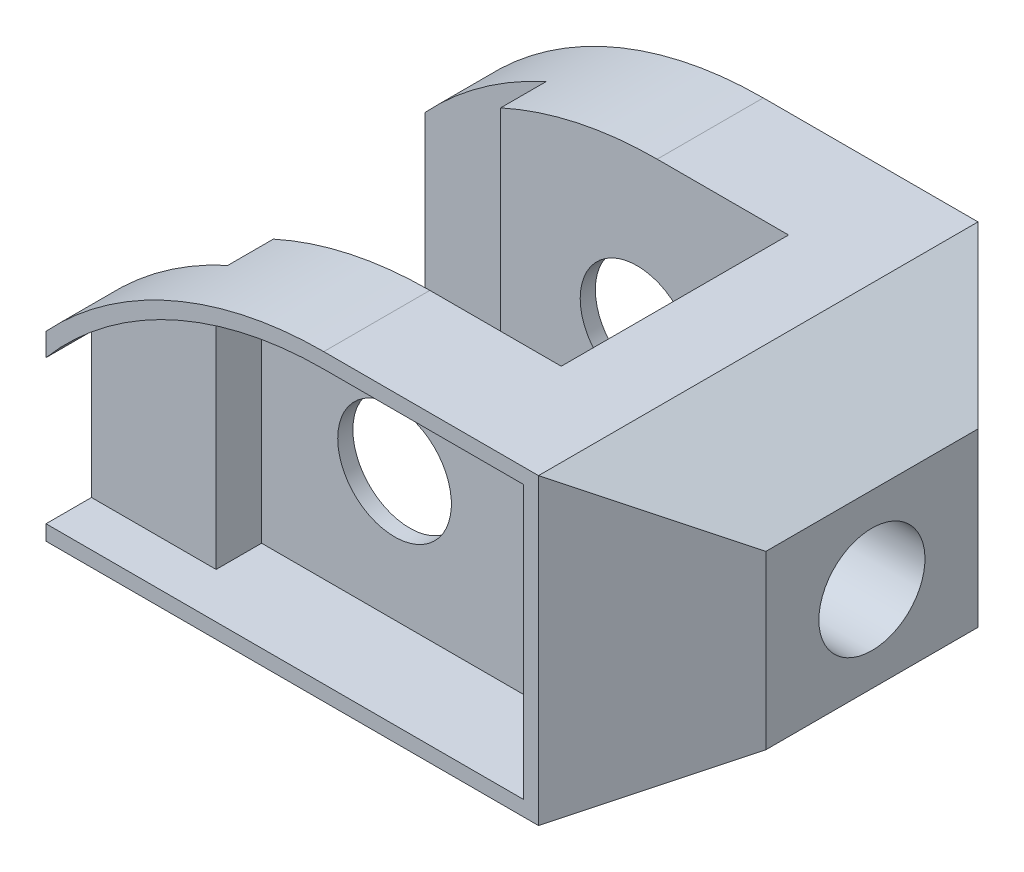
from build123d import *

# Parameters (mm, degrees)
SKETCH1_R               = 7.5
BOSS_EXTRUDE1_DEPTH     = 58
SKETCH2_W               = 17.33939444
SKETCH2_H               = 30
CUT_EXTRUDE1_DEPTH      = 107.60206377
CUT_EXTRUDE5_DEPTH      = 107.60206377
CUT_EXTRUDE5_DEPTH_BACK = 107.60206377
SKETCH3_R               = 7
CUT_EXTRUDE8_DEPTH      = 6
CUT_EXTRUDE9_DEPTH      = 12


with BuildPart() as part:
    # Sketch1 → Boss-Extrude1 (new body)
    with BuildSketch(Plane.XY):
        with BuildLine():
            Line((0, 0), (0, 24))
            ThreePointArc((0, 24), (16.66060556, 35.82575695), (36.66060556, 40))
            Line((36.66060556, 40), (65, 40))
            Line((65, 40), (80, 31.339745962))
            Line((80, 31.339745962), (80, 8.660254038))
            Line((80, 8.660254038), (65, 0))
            Line((65, 0), (0, 0))
        make_face()
        with Locations(Location((34, 19, 0), (0, 0, 180))):
            Circle(SKETCH1_R, mode=Mode.SUBTRACT)
    extrude(amount=BOSS_EXTRUDE1_DEPTH)

    # Sketch2 → Cut-Extrude1 (cut, through all)
    with BuildSketch(Plane(origin=(0, 40, 0), x_dir=(1, 0, 0), z_dir=(0, 1, 0))):
        Polygon((16, -8), (0, -8), (0, -50), (16, -50), (16, -44), (36.66060556, -44), (36.66060556, -14), (16, -14), align=None)
        with Locations((45.33030278, -29)):
            Rectangle(SKETCH2_W, SKETCH2_H)
        Polygon((80, 0), (65, 0), (80, -15), align=None)
        Polygon((80, -58), (80, -43), (65, -58), align=None)
    extrude(amount=-CUT_EXTRUDE1_DEPTH, mode=Mode.SUBTRACT)

    # Sketch3 → Cut-Extrude5 (cut, two sides: drawn at the far end of the back side and taken through both)
    with BuildSketch(Plane(origin=(80, 0, 0), x_dir=(0, 0, -1), z_dir=(1, 0, 0)).offset(-CUT_EXTRUDE5_DEPTH_BACK)):
        with Locations(Location((-29, 20, 0), (0, 0, 270))):
            Circle(SKETCH3_R)
    extrude(amount=CUT_EXTRUDE5_DEPTH + CUT_EXTRUDE5_DEPTH_BACK, mode=Mode.SUBTRACT)

    # Sketch7 → Cut-Extrude8 (cut)
    with BuildSketch(Plane.XY.offset(58)):
        with BuildLine():
            Line((16.452013389, 2), (16.452013389, 33.538635744))
            ThreePointArc((16.452013389, 33.538635744), (8.428320966, 28.819300697), (1.466424222, 22.64))
            ThreePointArc((1.466424222, 22.64), (0.7236706, 21.820381922), (0, 20.98386677))
            Line((0, 20.98386677), (0, 2))
            Line((0, 2), (16.452013389, 2))
        make_face()
    cut_extrude8 = extrude(amount=-CUT_EXTRUDE8_DEPTH, mode=Mode.SUBTRACT)

    # Sketch7<3> → Cut-Extrude9 (cut)
    with BuildSketch(Plane.XY.offset(58)):
        with BuildLine():
            ThreePointArc((36.66060556, 38), (26.3130096, 36.871390612), (16.452013389, 33.538635744))
            Line((16.452013389, 33.538635744), (16.452013389, 2))
            Line((16.452013389, 2), (63, 2))
            Line((63, 2), (63, 38))
            Line((63, 38), (36.66060556, 38))
        make_face()
    cut_extrude9 = extrude(amount=-CUT_EXTRUDE9_DEPTH, mode=Mode.SUBTRACT)

    # Mirror3: Cut-Extrude8, Cut-Extrude9 across plane
    add(cut_extrude8.mirror(Plane.XY.offset(29)), mode=Mode.SUBTRACT)
    add(cut_extrude9.mirror(Plane.XY.offset(29)), mode=Mode.SUBTRACT)


solid = part.part
